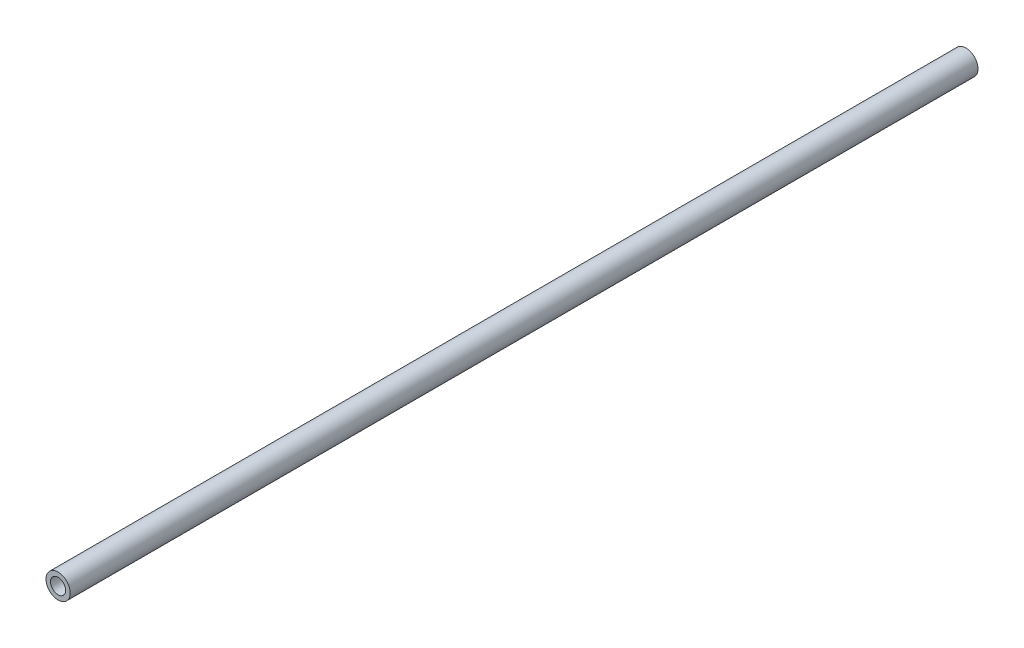
from build123d import *

# Parameters (mm, degrees)
SKETCH1_R           = 8
SKETCH1_R_2         = 5
BOSS_EXTRUDE1_DEPTH = 600


with BuildPart() as part:
    # Sketch1 → Boss-Extrude1 (new body)
    with BuildSketch(Plane.XY):
        Circle(SKETCH1_R)
        Circle(SKETCH1_R_2, mode=Mode.SUBTRACT)
    extrude(amount=BOSS_EXTRUDE1_DEPTH)


solid = part.part
